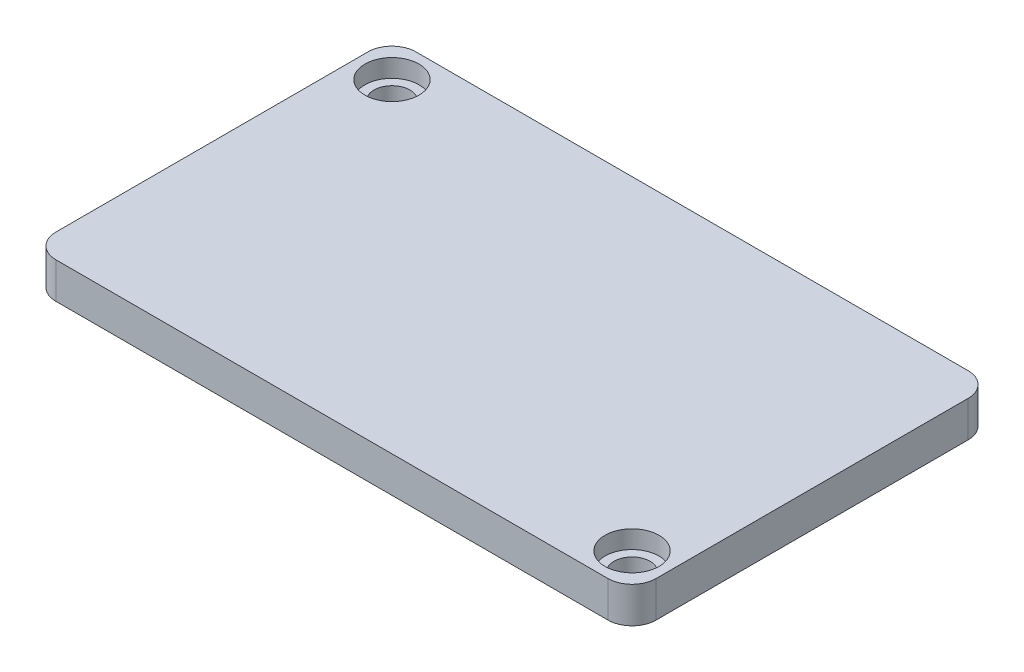
from build123d import *

# Parameters (mm, degrees)
CROQUIS2_W              = 50
CROQUIS2_H              = 30
SALIENTE_EXTRUIR2_DEPTH = 3
SALIENTE_EXTRUIR3_DEPTH = 2
REDONDEO1_R             = 2
CROQUIS6_R              = 1.5
CORTAR_EXTRUIR2_DEPTH   = 7
REDONDEO3_R             = 2
CROQUIS7_R              = 2.25
CORTAR_EXTRUIR3_DEPTH   = 1.5


with BuildPart() as part:
    # Croquis2 → Saliente-Extruir2 (new body)
    with BuildSketch(Plane(origin=(0, 0, 0), x_dir=(1, 0, 0), z_dir=(0, 1, 0))):
        Rectangle(CROQUIS2_W, CROQUIS2_H)
    extrude(amount=SALIENTE_EXTRUIR2_DEPTH)

    # Croquis3 → Saliente-Extruir3 (add)
    with BuildSketch(Plane.XZ):
        Polygon((-19, -12), (22, -12), (22, 9), (19, 9), (19, 12), (-22, 12), (-22, -9), (-19, -9), align=None)
    extrude(amount=SALIENTE_EXTRUIR3_DEPTH)

    # Redondeo1
    redondeo1_edges = [part.edges().sort_by_distance(p)[0] for p in [
        (25, 1.5, 15),
        (-25, 1.5, 15),
        (-25, 1.5, -15),
        (25, 1.5, -15),
    ]]
    fillet(redondeo1_edges, radius=REDONDEO1_R)

    # Croquis6 → Cortar-Extruir2 (cut)
    with BuildSketch(Plane.XZ):
        with Locations(Location((-22, -12, 0), (0, 0, 270))):
            Circle(CROQUIS6_R)
        with Locations(Location((22, 12, 0), (0, 0, 270))):
            Circle(CROQUIS6_R)
    extrude(amount=-CORTAR_EXTRUIR2_DEPTH, mode=Mode.SUBTRACT)

    # Redondeo3
    redondeo3_edges = [part.edges().sort_by_distance(p)[0] for p in [
        (-19, -1, -9),
        (19, -1, 9),
    ]]
    fillet(redondeo3_edges, radius=REDONDEO3_R)

    # Croquis7 → Cortar-Extruir3 (cut)
    with BuildSketch(Plane(origin=(0, 3, 0), x_dir=(1, 0, 0), z_dir=(0, 1, 0))):
        with Locations(Location((-22, 12, 0), (0, 0, 270))):
            Circle(CROQUIS7_R)
        with Locations(Location((22, -12, 0), (0, 0, 270))):
            Circle(CROQUIS7_R)
    extrude(amount=-CORTAR_EXTRUIR3_DEPTH, mode=Mode.SUBTRACT)


solid = part.part
